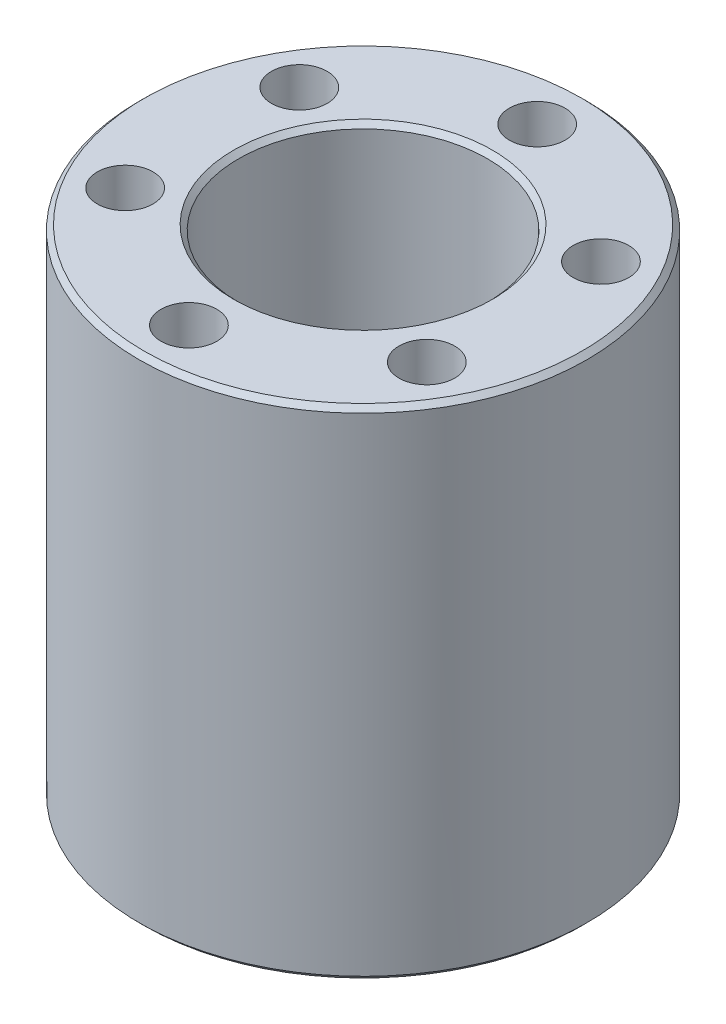
from build123d import *

# Parameters (mm, degrees)
SKETCH2_W                           = 10
SKETCH2_H                           = 25
F_5_6_5_6_DIAMETER_HOLE1_AT_2_COUNT = 2
F_5_6_5_6_DIAMETER_HOLE1_AT_2_PITCH = 17.5
F_5_6_5_6_DIAMETER_HOLE1_AT_3_COUNT = 2
F_5_6_5_6_DIAMETER_HOLE1_AT_3_PITCH = 30.310889132
F_5_6_5_6_DIAMETER_HOLE1_AT_4_COUNT = 2
F_5_6_5_6_DIAMETER_HOLE1_AT_4_PITCH = 35
F_5_6_5_6_DIAMETER_HOLE1_AT_5_COUNT = 2
F_5_6_5_6_DIAMETER_HOLE1_AT_5_PITCH = 30.310889132
F_5_6_5_6_DIAMETER_HOLE1_AT_6_COUNT = 2
F_5_6_5_6_DIAMETER_HOLE1_AT_6_PITCH = 17.5
F_0_5MM_CHAMFER1_SIZE               = 0.5


with BuildPart() as part:
    # Sketch2 → Revolve1 (revolve)
    with BuildSketch(Plane.XY, mode=Mode.PRIVATE) as revolve1_sk:
        with Locations((17.5, 12.5)):
            Rectangle(SKETCH2_W, SKETCH2_H)
    revolve1 = revolve(revolve1_sk.sketch.rotate(Axis((0, 0, 0), (0, 1, 0)), 90), axis=Axis((0, 0, 0), (0, 1, 0)))

    # Sketch5 → Ø5.6 (5.6) Diameter Hole1 (revolve, cut)
    with BuildSketch(Plane(origin=(15.155444566, 25, 8.75), x_dir=(0, 0, 1), z_dir=(1, 0, 0))):
        Polygon((0, 0), (0, 9.682409733), (2.8, 8), (2.8, 0), align=None)
    f_5_6_5_6_diameter_hole1 = revolve(axis=Axis((15.155444566, 31.35, 8.75), (0, -1, 0)), mode=Mode.SUBTRACT)

    # Ø5.6 (5.6) Diameter Hole1 at 2: Ø5.6 (5.6) Diameter Hole1 ×2
    with Locations(*[Vector(-0.8660254037844417, 0, 0.49999999999999495) * (i * F_5_6_5_6_DIAMETER_HOLE1_AT_2_PITCH) for i in range(1, F_5_6_5_6_DIAMETER_HOLE1_AT_2_COUNT)]):
        add(f_5_6_5_6_diameter_hole1, mode=Mode.SUBTRACT)

    # Ø5.6 (5.6) Diameter Hole1 at 3: Ø5.6 (5.6) Diameter Hole1 ×2
    with Locations(*[(-i * F_5_6_5_6_DIAMETER_HOLE1_AT_3_PITCH, 0, 0) for i in range(1, F_5_6_5_6_DIAMETER_HOLE1_AT_3_COUNT)]):
        add(f_5_6_5_6_diameter_hole1, mode=Mode.SUBTRACT)

    # Ø5.6 (5.6) Diameter Hole1 at 4: Ø5.6 (5.6) Diameter Hole1 ×2
    with Locations(*[Vector(-0.8660254037844346, 0, -0.5000000000000072) * (i * F_5_6_5_6_DIAMETER_HOLE1_AT_4_PITCH) for i in range(1, F_5_6_5_6_DIAMETER_HOLE1_AT_4_COUNT)]):
        add(f_5_6_5_6_diameter_hole1, mode=Mode.SUBTRACT)

    # Ø5.6 (5.6) Diameter Hole1 at 5: Ø5.6 (5.6) Diameter Hole1 ×2
    with Locations(*[Vector(-0.49999999999999195, 0, -0.8660254037844433) * (i * F_5_6_5_6_DIAMETER_HOLE1_AT_5_PITCH) for i in range(1, F_5_6_5_6_DIAMETER_HOLE1_AT_5_COUNT)]):
        add(f_5_6_5_6_diameter_hole1, mode=Mode.SUBTRACT)

    # Ø5.6 (5.6) Diameter Hole1 at 6: Ø5.6 (5.6) Diameter Hole1 ×2
    with Locations(*[(0, 0, -i * F_5_6_5_6_DIAMETER_HOLE1_AT_6_PITCH) for i in range(1, F_5_6_5_6_DIAMETER_HOLE1_AT_6_COUNT)]):
        add(f_5_6_5_6_diameter_hole1, mode=Mode.SUBTRACT)

    # Mirror1: Revolve1, Ø5.6 (5.6) Diameter Hole1 across plane
    add(revolve1.mirror(Plane.ZX))
    add(f_5_6_5_6_diameter_hole1.mirror(Plane.ZX), mode=Mode.SUBTRACT)

    # Mirror1 copy 1 sketch → Mirror1 copy 1 (revolve, cut)
    with BuildSketch(Plane(origin=(0, -25, 17.5), x_dir=(0, 0, 1), z_dir=(1, 0, 0))):
        Polygon((0, 0), (0, -9.682409733), (2.8, -8), (2.8, 0), align=None)
    revolve(axis=Axis((0, -31.35, 17.5), (0, -1, 0)), mode=Mode.SUBTRACT)

    # Mirror1 copy 2 sketch → Mirror1 copy 2 (revolve, cut)
    with BuildSketch(Plane(origin=(-15.155444566, -25, 8.75), x_dir=(0, 0, 1), z_dir=(1, 0, 0))):
        Polygon((0, 0), (0, -9.682409733), (2.8, -8), (2.8, 0), align=None)
    revolve(axis=Axis((-15.155444566, -31.35, 8.75), (0, -1, 0)), mode=Mode.SUBTRACT)

    # Mirror1 copy 3 sketch → Mirror1 copy 3 (revolve, cut)
    with BuildSketch(Plane(origin=(-15.155444566, -25, -8.75), x_dir=(0, 0, 1), z_dir=(1, 0, 0))):
        Polygon((0, 0), (0, -9.682409733), (2.8, -8), (2.8, 0), align=None)
    revolve(axis=Axis((-15.155444566, -31.35, -8.75), (0, -1, 0)), mode=Mode.SUBTRACT)

    # Mirror1 copy 4 sketch → Mirror1 copy 4 (revolve, cut)
    with BuildSketch(Plane(origin=(0, -25, -17.5), x_dir=(0, 0, 1), z_dir=(1, 0, 0))):
        Polygon((0, 0), (0, -9.682409733), (2.8, -8), (2.8, 0), align=None)
    revolve(axis=Axis((0, -31.35, -17.5), (0, -1, 0)), mode=Mode.SUBTRACT)

    # Mirror1 copy 5 sketch → Mirror1 copy 5 (revolve, cut)
    with BuildSketch(Plane(origin=(15.155444566, -25, -8.75), x_dir=(0, 0, 1), z_dir=(1, 0, 0))):
        Polygon((0, 0), (0, -9.682409733), (2.8, -8), (2.8, 0), align=None)
    revolve(axis=Axis((15.155444566, -31.35, -8.75), (0, -1, 0)), mode=Mode.SUBTRACT)

    # 0,5mm Chamfer1
    f_0_5mm_chamfer1_edges = [part.edges().sort_by_distance(p)[0] for p in [
        (0, -25, 12.5),
        (0, -25, 22.5),
        (0, 25, 22.5),
        (0, 25, 12.5),
    ]]
    chamfer(f_0_5mm_chamfer1_edges, length=F_0_5MM_CHAMFER1_SIZE)


solid = part.part
